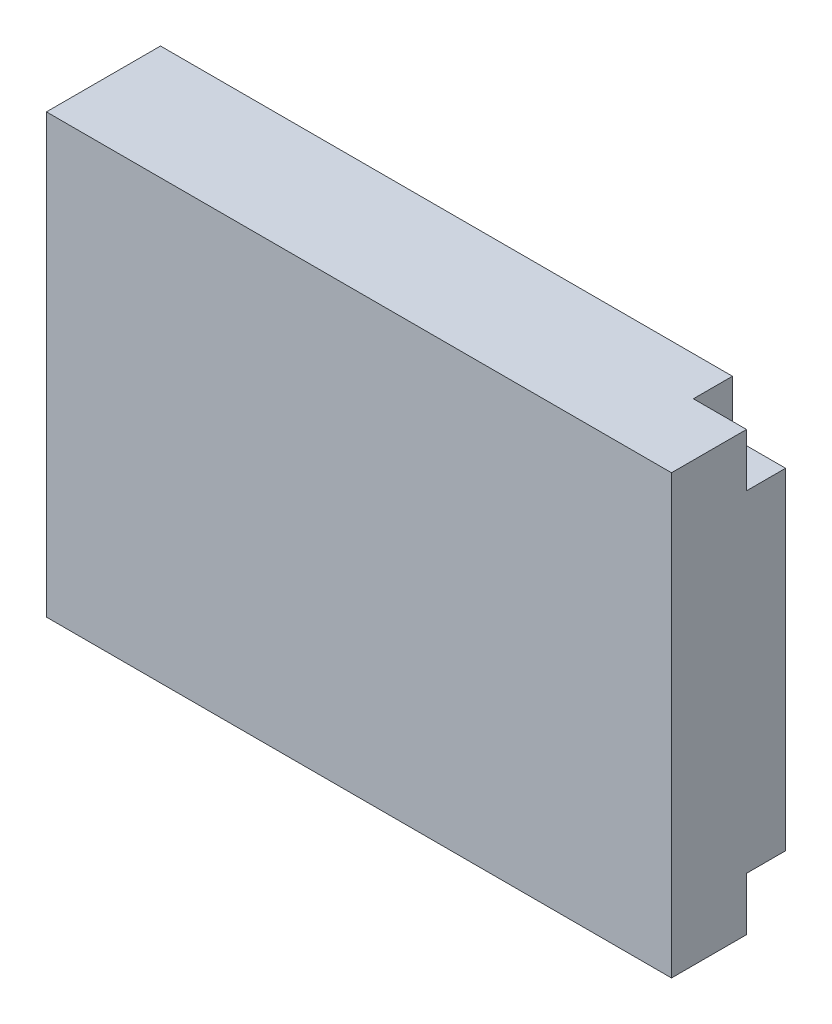
from build123d import *

# Parameters (mm, degrees)
SKIZZE1_W                       = 20
SKIZZE1_H                       = 14
AUFSATZ_LINEAR_AUSTRAGEN1_DEPTH = 3.65
SKIZZE2_W                       = 1.7
SKIZZE2_H                       = 1.7
SCHNITT_LINEAR_AUSTRAGEN1_DEPTH = 1.25


with BuildPart() as part:
    # Skizze1 → Aufsatz-Linear austragen1 (new body)
    with BuildSketch(Plane.XY):
        Rectangle(SKIZZE1_W, SKIZZE1_H)
    extrude(amount=AUFSATZ_LINEAR_AUSTRAGEN1_DEPTH)

    # Skizze2 → Schnitt-Linear austragen1 (cut)
    with BuildSketch(Plane.XY):
        with Locations((9.15, 6.15)):
            Rectangle(SKIZZE2_W, SKIZZE2_H)
        with Locations((9.15, -6.15)):
            Rectangle(SKIZZE2_W, SKIZZE2_H)
    extrude(amount=SCHNITT_LINEAR_AUSTRAGEN1_DEPTH, mode=Mode.SUBTRACT)


solid = part.part
